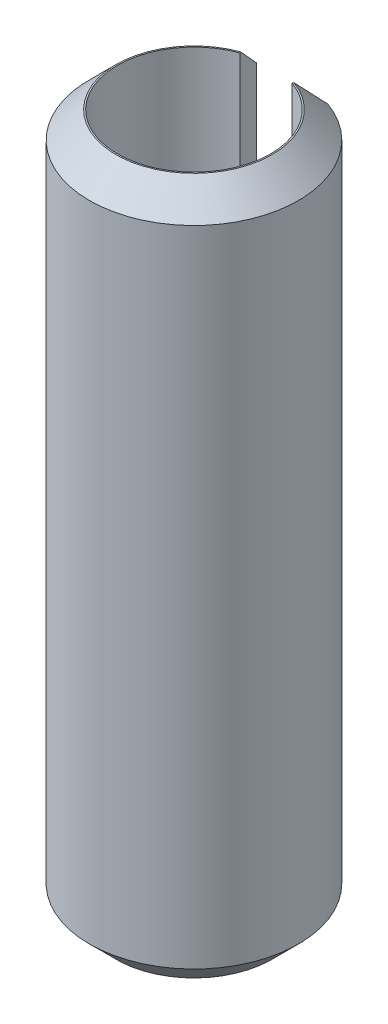
from build123d import *

# Parameters (mm, degrees)
EXTRUDE_LENGTH_DEPTH = 5
END_CHAMFERS_SIZE    = 0.19


with BuildPart() as part:
    # Cross Section Sketch → Extrude Length (new body)
    with BuildSketch(Plane(origin=(0, 0, 0), x_dir=(1, 0, 0), z_dir=(0, 1, 0))):
        with BuildLine():
            Line((0.188111079, 0.516830941), (0.256515107, 0.704769466))
            ThreePointArc((0.256515107, 0.704769466), (0, -0.75), (-0.256515107, 0.704769466))
            Line((-0.256515107, 0.704769466), (-0.188111079, 0.516830941))
            ThreePointArc((-0.188111079, 0.516830941), (0, -0.55), (0.188111079, 0.516830941))
        make_face()
    extrude(amount=EXTRUDE_LENGTH_DEPTH)

    # End Chamfers
    end_chamfers_edges = [part.edges().sort_by_distance(p)[0] for p in [
        (0, 5, 0.75),
        (0, 0, 0.75),
    ]]
    chamfer(end_chamfers_edges, length=END_CHAMFERS_SIZE)


solid = part.part
